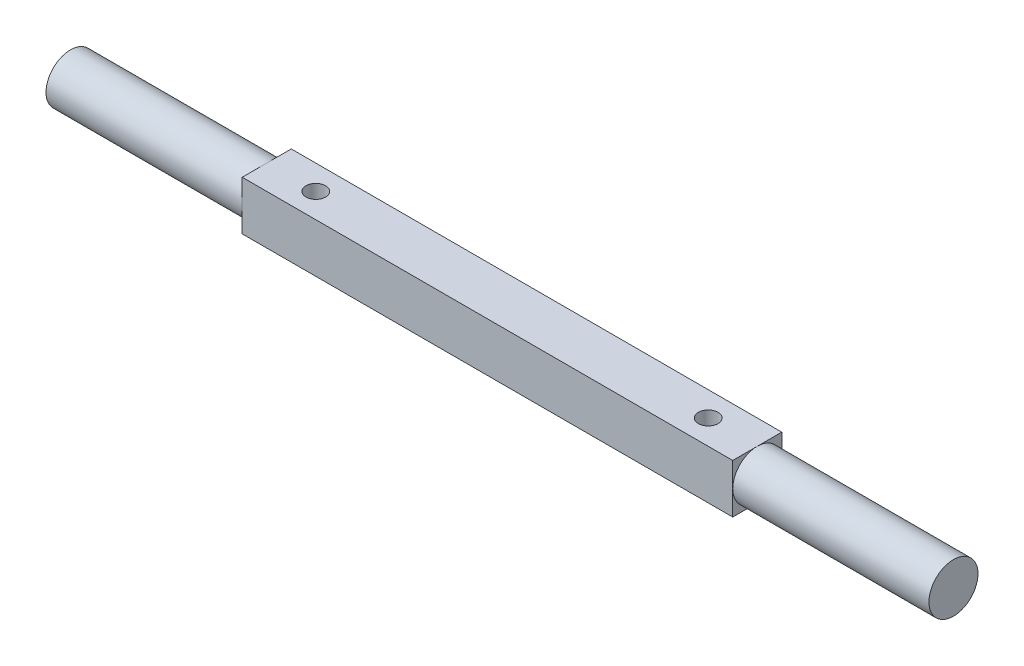
from build123d import *

# Parameters (mm, degrees)
SKETCH1_W           = 500
SKETCH1_H           = 50
BOSS_EXTRUDE1_DEPTH = 25
SKETCH2_R           = 10
CUT_EXTRUDE1_DEPTH  = 257.173769149
SKETCH4_R           = 25
BOSS_EXTRUDE2_DEPTH = 200
BOSS_EXTRUDE3_START = 200
SKETCH5_R           = 25
BOSS_EXTRUDE3_DEPTH = 200


with BuildPart() as part:
    # Sketch1 → Boss-Extrude1 (new, symmetric)
    with BuildSketch(Plane(origin=(0, 0, 0), x_dir=(1, 0, 0), z_dir=(0, 1, 0))):
        Rectangle(SKETCH1_W, SKETCH1_H)
    extrude(amount=BOSS_EXTRUDE1_DEPTH, both=True)

    # Sketch2 → Cut-Extrude1 (cut, through all)
    with BuildSketch(Plane(origin=(0, 25, 0), x_dir=(1, 0, 0), z_dir=(0, 1, 0))):
        with Locations(Location((200, 0, 0), (0, 0, 270))):
            Circle(SKETCH2_R)
        with Locations(Location((-200, 0, 0), (0, 0, 90))):
            Circle(SKETCH2_R)
    extrude(amount=-CUT_EXTRUDE1_DEPTH, mode=Mode.SUBTRACT)

    # Sketch4 → Boss-Extrude2 (add)
    with BuildSketch(Plane(origin=(250, 0, 0), x_dir=(0, 0, -1), z_dir=(1, 0, 0))):
        Circle(SKETCH4_R)
    extrude(amount=BOSS_EXTRUDE2_DEPTH)

    # Sketch5 → Boss-Extrude3 (add)
    with BuildSketch(Plane.ZY.offset(250).offset(BOSS_EXTRUDE3_START)):
        with Locations(Location((0, 0, 0), (0, 0, 180))):
            Circle(SKETCH5_R)
    extrude(amount=-BOSS_EXTRUDE3_DEPTH)


solid = part.part
